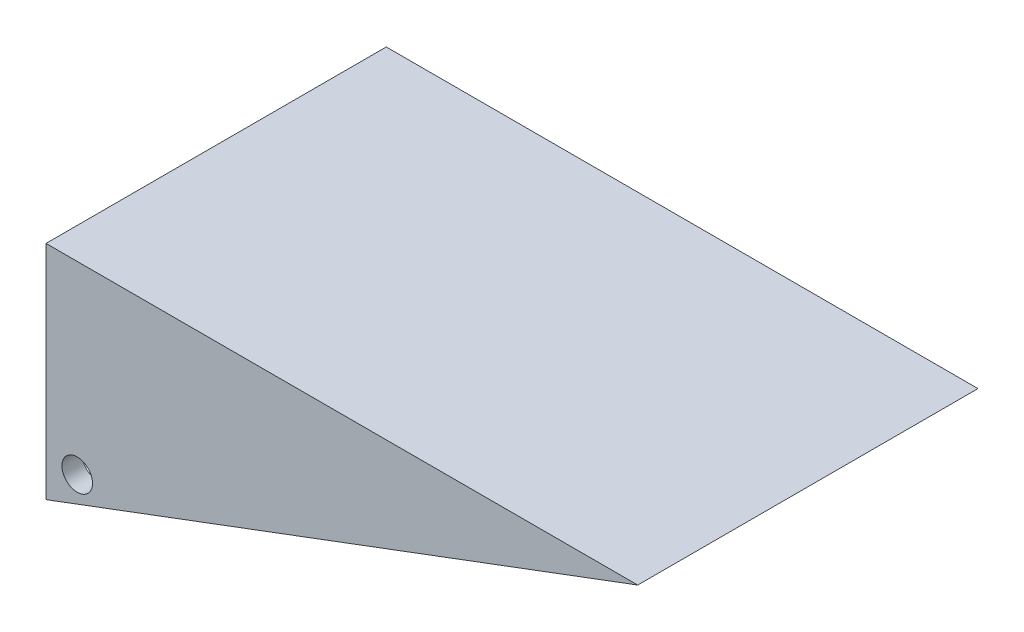
from build123d import *

# Parameters (mm, degrees)
BOSS_EXTRUDE2_DEPTH      = 22
BOSS_EXTRUDE2_DEPTH_BACK = 1
SKETCH2_W                = 20.249570214
SKETCH2_H                = 13.731042716
CUT_EXTRUDE1_DEPTH       = 43
SKETCH3_R                = 1.034515854
CUT_EXTRUDE2_DEPTH       = 43


with BuildPart() as part:
    # Sketch1 → Boss-Extrude2 (new, two sides: drawn at the far end of the back side and taken through both)
    with BuildSketch(Plane.XY.offset(-BOSS_EXTRUDE2_DEPTH_BACK)):
        Polygon((0, 0), (0, 15), (40, 15), align=None)
    extrude(amount=BOSS_EXTRUDE2_DEPTH + BOSS_EXTRUDE2_DEPTH_BACK)

    # Sketch2 → Cut-Extrude1 (cut)
    with BuildSketch(Plane.ZY):
        with Locations((10.512392638, 6.669693265)):
            Rectangle(SKETCH2_W, SKETCH2_H)
    extrude(amount=-CUT_EXTRUDE1_DEPTH, mode=Mode.SUBTRACT)

    # Sketch3 → Cut-Extrude2 (cut)
    with BuildSketch(Plane.XY.offset(22)):
        with Locations((2.111496697, 2.521392454)):
            Circle(SKETCH3_R)
    extrude(amount=-CUT_EXTRUDE2_DEPTH, mode=Mode.SUBTRACT)


solid = part.part
